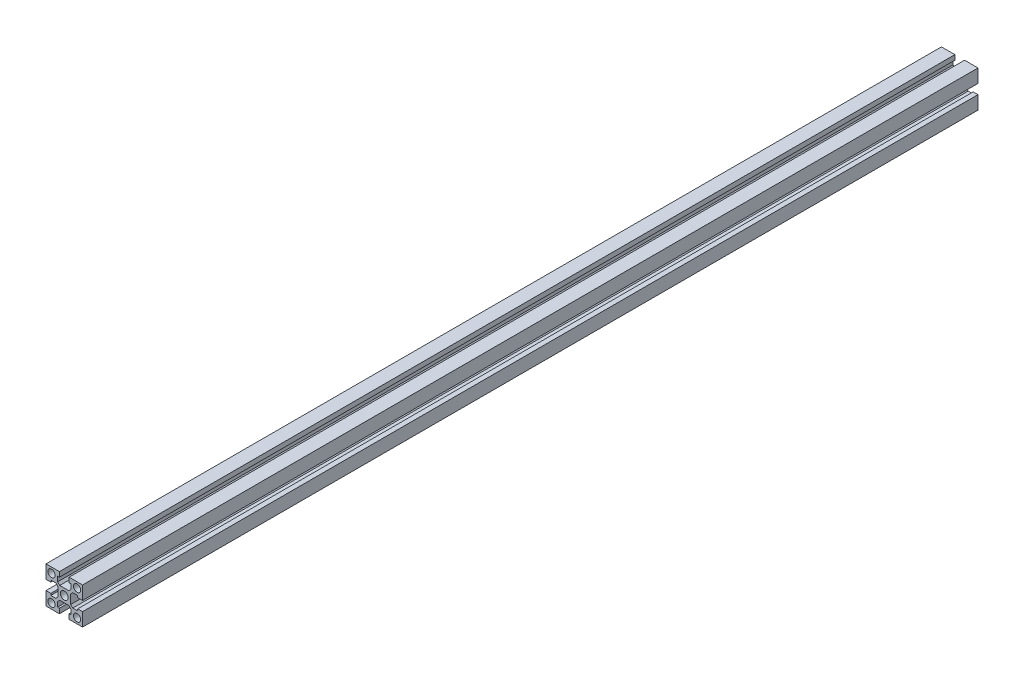
from build123d import *

# Parameters (mm, degrees)
SKETCH_1_R      = 2
SKETCH_1_R_2    = 2.15
EXTRUDE_1_DEPTH = 245


with BuildPart() as part:
    # 스케치1 → 보스-돌출1 (new, symmetric)
    with BuildSketch(Plane.XY):
        Polygon((-10, -10), (-2.65, -10), (-2.65, -7.35), (-3.65, -7.35), (-3.65, -4.639949494), (-2.510050506, -3.5), (0, -3.5), (2.510050506, -3.5), (3.65, -4.639949494), (3.65, -7.35), (2.65, -7.35), (2.65, -10), (10, -10), (10, -2.65), (7.35, -2.65), (7.35, -3.65), (4.639949494, -3.65), (3.5, -2.510050506), (3.5, 0), (3.5, 2.510050506), (4.639949494, 3.65), (7.35, 3.65), (7.35, 2.65), (10, 2.65), (10, 10), (2.65, 10), (2.65, 7.35), (3.65, 7.35), (3.65, 4.639949494), (2.510050506, 3.5), (0, 3.5), (-2.510050506, 3.5), (-3.65, 4.639949494), (-3.65, 7.35), (-2.65, 7.35), (-2.65, 10), (-10, 10), (-10, 2.65), (-7.35, 2.65), (-7.35, 3.65), (-4.639949494, 3.65), (-3.5, 2.510050506), (-3.5, 0), (-3.5, -2.510050506), (-4.639949494, -3.65), (-7.35, -3.65), (-7.35, -2.65), (-10, -2.65), align=None)
        with Locations((-7, 7)):
            Circle(SKETCH_1_R, mode=Mode.SUBTRACT)
        Circle(SKETCH_1_R_2, mode=Mode.SUBTRACT)
        with Locations((7, 7)):
            Circle(SKETCH_1_R, mode=Mode.SUBTRACT)
        with Locations((-7, -7)):
            Circle(SKETCH_1_R, mode=Mode.SUBTRACT)
        with Locations((7, -7)):
            Circle(SKETCH_1_R, mode=Mode.SUBTRACT)
    extrude(amount=EXTRUDE_1_DEPTH, both=True)


solid = part.part
